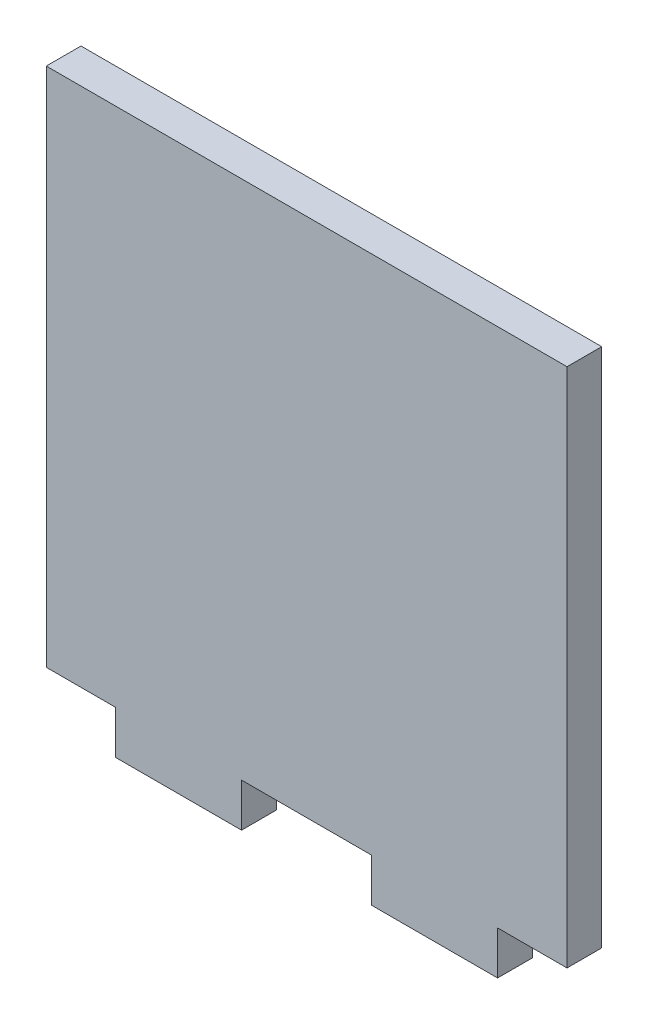
from build123d import *

# Parameters (mm, degrees)
SKETCH1_W           = 60
SKETCH1_H           = 4
BOSS_EXTRUDE1_DEPTH = 60
SKETCH2_W           = 14.5
SKETCH2_H           = 4
BOSS_EXTRUDE2_DEPTH = 5


with BuildPart() as part:
    # Sketch1 → Boss-Extrude1 (new body)
    with BuildSketch(Plane(origin=(0, 0, 0), x_dir=(1, 0, 0), z_dir=(0, 1, 0))):
        Rectangle(SKETCH1_W, SKETCH1_H)
    extrude(amount=BOSS_EXTRUDE1_DEPTH)

    # Sketch2 → Boss-Extrude2 (add)
    with BuildSketch(Plane(origin=(0, 0, 0), x_dir=(-1, 0, 0), z_dir=(0, -1, 0))):
        with Locations((14.75, 0)):
            Rectangle(SKETCH2_W, SKETCH2_H)
        with Locations((-14.75, 0)):
            Rectangle(SKETCH2_W, SKETCH2_H)
    extrude(amount=BOSS_EXTRUDE2_DEPTH)


solid = part.part
